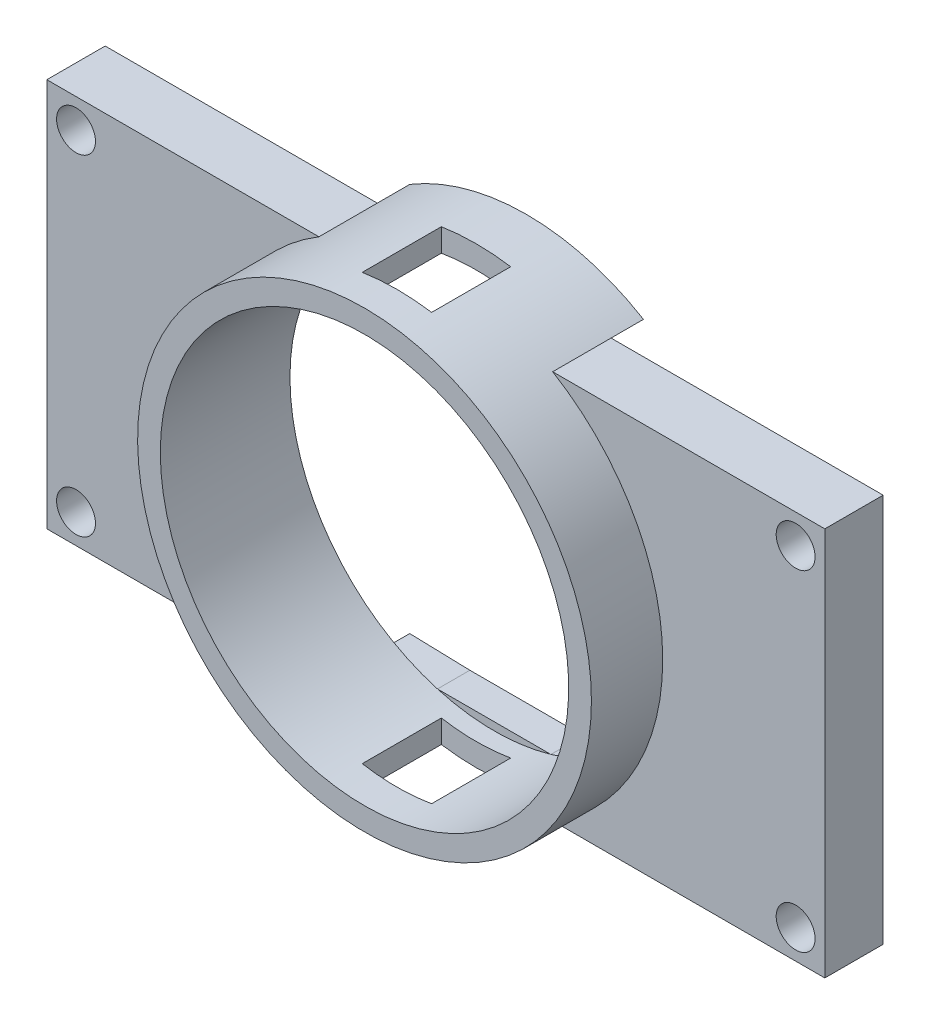
from build123d import *
from build123d.topology import SkipClean

# Parameters (mm, degrees)
SKETCH1_R               = 33.5
BOSS_EXTRUDE1_DEPTH     = 20
SKETCH1_5_R             = 3
SKETCH1_5_R_2           = 1.5
BOSS_EXTRUDE3_DEPTH     = 4
BOSS_EXTRUDE3_2_DEPTH   = 4
BOSS_EXTRUDE3_3_DEPTH   = 4
BOSS_EXTRUDE3_4_DEPTH   = 4
SKETCH1_6_R             = 3
BOSS_EXTRUDE4_DEPTH     = 9
CUT_EXTRUDE2_DEPTH      = 22
CUT_EXTRUDE2_DEPTH_BACK = 76
SKETCH3_W               = 10.7
SKETCH3_H               = 12.2
SKETCH5_R               = 35
SKETCH5_R_2             = 31.5
BOSS_EXTRUDE9_DEPTH     = 20
BOSS_EXTRUDE11_START    = 5
BOSS_EXTRUDE11_DEPTH    = 5
CUT_EXTRUDE3_DEPTH      = 22
CUT_EXTRUDE3_DEPTH_BACK = 92
SKETCH3_2_W             = 10.7
SKETCH3_2_H             = 12.2


with BuildPart() as part:
    # Sketch1 → Boss-Extrude1 (new body)
    with BuildSketch(Plane.XY):
        with BuildLine():
            ThreePointArc((19.927805895, 33.550317981), (1.900049518, 38.550317981), (-16.12770686, 33.550317981))
            ThreePointArc((-16.12770686, 33.550317981), (-33.099950482, 3.550317981), (-16.12770686, -26.449682019))
            ThreePointArc((-16.12770686, -26.449682019), (1.900049518, -31.449682019), (19.927805895, -26.449682019))
            ThreePointArc((19.927805895, -26.449682019), (32.362907831, -13.683783776), (36.900049518, 3.550317981))
            ThreePointArc((36.900049518, 3.550317981), (32.362907831, 20.784419739), (19.927805895, 33.550317981))
        make_face()
        with Locations((1.900049518, 3.550317981)):
            Circle(SKETCH1_R, mode=Mode.SUBTRACT)
    extrude(amount=BOSS_EXTRUDE1_DEPTH)



with BuildPart() as body_2:
    # Sketch1<5> → Boss-Extrude3 (new body)
    with BuildSketch(Plane.XY):
        with Locations((-53.599950482, -21.949682019)):
            Circle(SKETCH1_5_R)
        with Locations((-53.599950482, -21.949682019)):
            Circle(SKETCH1_5_R_2, mode=Mode.SUBTRACT)
    extrude(amount=BOSS_EXTRUDE3_DEPTH)


with BuildPart() as body_3:
    # Sketch1<5> → Boss-Extrude3 2 (new body)
    with BuildSketch(Plane.XY):
        with Locations((-53.599950482, 29.050317981)):
            Circle(SKETCH1_5_R)
        with Locations((-53.599950482, 29.050317981)):
            Circle(SKETCH1_5_R_2, mode=Mode.SUBTRACT)
    extrude(amount=BOSS_EXTRUDE3_2_DEPTH)


with BuildPart() as body_4:
    # Sketch1<5> → Boss-Extrude3 3 (new body)
    with BuildSketch(Plane.XY):
        with Locations((57.400049518, 29.050317981)):
            Circle(SKETCH1_5_R)
        with Locations((57.400049518, 29.050317981)):
            Circle(SKETCH1_5_R_2, mode=Mode.SUBTRACT)
    extrude(amount=BOSS_EXTRUDE3_3_DEPTH)


with BuildPart() as body_5:
    # Sketch1<5> → Boss-Extrude3 4 (new body)
    with BuildSketch(Plane.XY):
        with Locations((57.400049518, -21.949682019)):
            Circle(SKETCH1_5_R)
        with Locations((57.400049518, -21.949682019)):
            Circle(SKETCH1_5_R_2, mode=Mode.SUBTRACT)
    extrude(amount=BOSS_EXTRUDE3_4_DEPTH)


with BuildPart() as part_1:
    add(part.part)

    add(body_2.part)  # Boss-Extrude4 merges body 2

    add(body_3.part)  # Boss-Extrude4 merges body 3

    add(body_4.part)  # Boss-Extrude4 merges body 4

    add(body_5.part)  # Boss-Extrude4 merges body 5
    # Sketch1<6> → Boss-Extrude4 (add)
    # profile 1 of 2: a face of its own
    with BuildSketch(Plane.XY):
        with BuildLine():
            Line((-16.12770686, 33.550317981), (-58.099950482, 33.550317981))
            Line((-58.099950482, 33.550317981), (-58.099950482, -26.449682019))
            Line((-58.099950482, -26.449682019), (-16.12770686, -26.449682019))
            ThreePointArc((-16.12770686, -26.449682019), (-33.099950482, 3.550317981), (-16.12770686, 33.550317981))
        make_face()
        with Locations((-53.599950482, -21.949682019)):
            Circle(SKETCH1_6_R, mode=Mode.SUBTRACT)
        with Locations((-53.599950482, 29.050317981)):
            Circle(SKETCH1_6_R, mode=Mode.SUBTRACT)
    # profile 2 of 2: a face of its own
    with BuildSketch(Plane.XY):
        with BuildLine():
            Line((61.900049518, 33.550317981), (19.927805895, 33.550317981))
            ThreePointArc((19.927805895, 33.550317981), (36.900049518, 3.550317981), (19.927805895, -26.449682019))
            Line((19.927805895, -26.449682019), (61.900049518, -26.449682019))
            Line((61.900049518, -26.449682019), (61.900049518, 33.550317981))
        make_face()
        with Locations((57.400049518, -21.949682019)):
            Circle(SKETCH1_6_R, mode=Mode.SUBTRACT)
        with Locations((57.400049518, 29.050317981)):
            Circle(SKETCH1_6_R, mode=Mode.SUBTRACT)
    extrude(amount=BOSS_EXTRUDE4_DEPTH)

    # Sketch3 → Cut-Extrude2 (cut, two sides: drawn at the far end of the back side and taken through both)
    with BuildSketch(Plane(origin=(0, -26.449682019, 0), x_dir=(-1, 0, 0), z_dir=(0, -1, 0)).offset(-CUT_EXTRUDE2_DEPTH_BACK)):
        with Locations((-1.900049518, -8.9)):
            Rectangle(SKETCH3_W, SKETCH3_H)
    extrude(amount=CUT_EXTRUDE2_DEPTH + CUT_EXTRUDE2_DEPTH_BACK, mode=Mode.SUBTRACT)

    # Sketch5 → Boss-Extrude9 (add)
    with BuildSketch(Plane(origin=(0, 0, 0), x_dir=(-1, 0, 0), z_dir=(0, 0, -1))):
        with Locations((-1.900049518, 3.550317981)):
            Circle(SKETCH5_R)
        with Locations((-1.900049518, 3.550317981)):
            Circle(SKETCH5_R_2, mode=Mode.SUBTRACT)
    extrude(amount=-BOSS_EXTRUDE9_DEPTH)

    # Sketch5<11> → Boss-Extrude11 (add)
    with SkipClean():  # the faces are left unmerged after this step: merging them gives an invalid solid
        with BuildSketch(Plane(origin=(0, 0, 0), x_dir=(-1, 0, 0), z_dir=(0, 0, -1)).offset(BOSS_EXTRUDE11_START)):
            with BuildLine():
                ThreePointArc((-19.927805895, -26.449682019), (-1.900049518, -31.449682019), (16.12770686, -26.449682019))
                Line((16.12770686, -26.449682019), (6.84749343, -26.710721201))
                Line((6.84749343, -26.710721201), (-10.647592465, -26.710721201))
                Line((-10.647592465, -26.710721201), (-19.927805895, -26.449682019))
            make_face()
            with BuildLine():
                ThreePointArc((16.12770686, 33.550317981), (-1.900049518, 38.550317981), (-19.927805895, 33.550317981))
                Line((-19.927805895, 33.550317981), (-10.647592465, 33.811357163))
                Line((-10.647592465, 33.811357163), (6.84749343, 33.811357163))
                Line((6.84749343, 33.811357163), (16.12770686, 33.550317981))
            make_face()
        extrude(amount=-BOSS_EXTRUDE11_DEPTH)

    # Sketch3<2> → Cut-Extrude3 (cut, two sides: drawn at the far end of the back side and taken through both)
    with SkipClean():  # the faces are left unmerged after this step: merging them gives an invalid solid
        with BuildSketch(Plane(origin=(0, -26.449682019, 0), x_dir=(-1, 0, 0), z_dir=(0, -1, 0)).offset(-CUT_EXTRUDE3_DEPTH_BACK)):
            with Locations((-1.900049518, -8.9)):
                Rectangle(SKETCH3_2_W, SKETCH3_2_H)
        extrude(amount=CUT_EXTRUDE3_DEPTH + CUT_EXTRUDE3_DEPTH_BACK, mode=Mode.SUBTRACT)


solid = part_1.part
